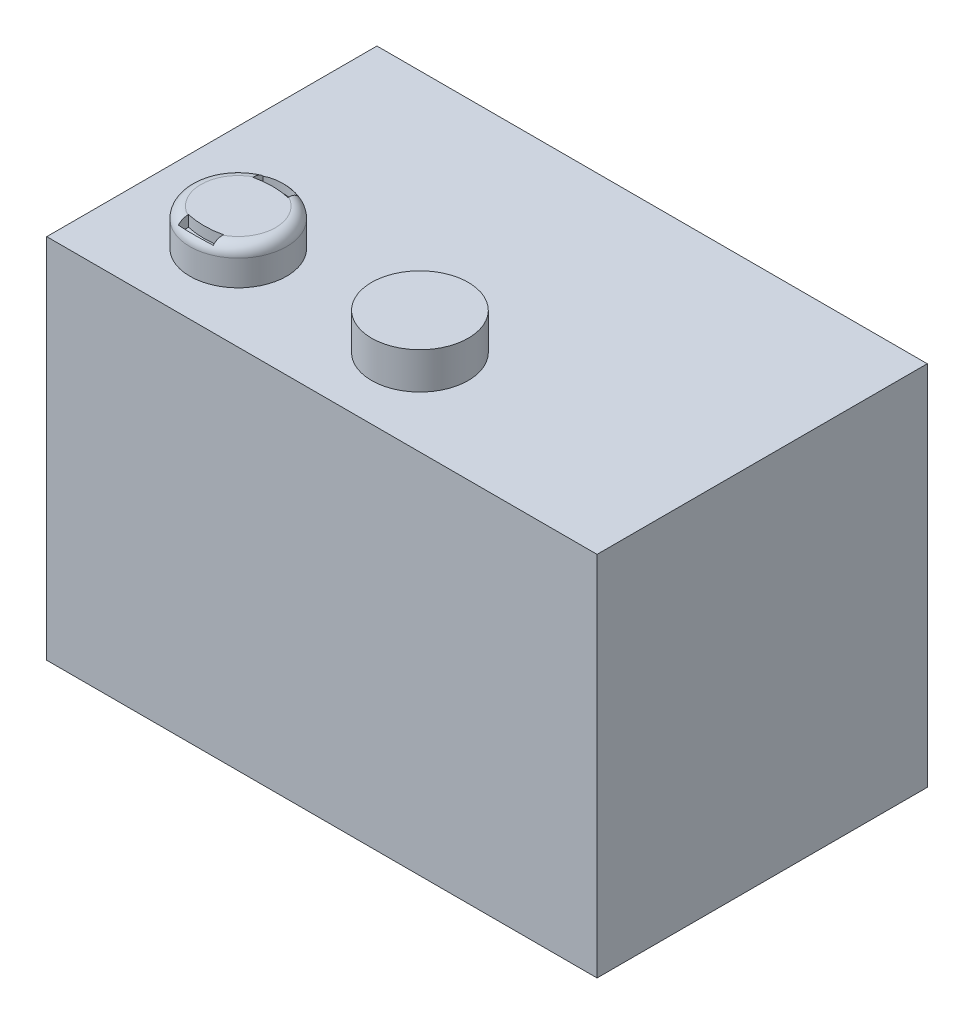
from build123d import *

# Parameters (mm, degrees)
ESQUISSE1_W             = 150
ESQUISSE1_H             = 100
BOSS_EXTRU_1_DEPTH      = 90
ESQUISSE2_R             = 13.17894546
BOSS_EXTRU_2_DEPTH      = 10
BOSS_EXTRU_2_2_DEPTH    = 10
CONG_1_R                = 3
ENL_V_MAT_EXTRU_3_DEPTH = 3


with BuildPart() as part:
    # Esquisse1 → Boss.-Extru.1 (new body)
    with BuildSketch(Plane.XY):
        with Locations((75, -50)):
            Rectangle(ESQUISSE1_W, ESQUISSE1_H)
    extrude(amount=BOSS_EXTRU_1_DEPTH)


with BuildPart() as body_2:
    # Esquisse2 → Boss.-Extru.2 (new body)
    with BuildSketch(Plane(origin=(0, 0, 0), x_dir=(1, 0, 0), z_dir=(0, 1, 0))):
        with Locations(Location((28.873561902, -66.674797835, 0), (0, 0, 270))):
            Circle(ESQUISSE2_R)
    extrude(amount=BOSS_EXTRU_2_DEPTH)

    # Congé1
    cong_1_edges = [body_2.edges().sort_by_distance(p)[0] for p in [
        (28.873561902, 10, 53.495852375),
    ]]
    fillet(cong_1_edges, radius=CONG_1_R)

    # Esquisse3 → Enlèv. mat.-Extru.3 (cut)
    with BuildSketch(Plane(origin=(0, 10, 0), x_dir=(1, 0, 0), z_dir=(0, 1, 0))):
        with BuildLine():
            Line((24.11468515, -75.462687014), (24.11468515, -78.244799577))
            ThreePointArc((24.11468515, -78.244799577), (28.873561902, -78.787682402), (33.632438654, -78.244799577))
            Line((33.632438654, -78.244799577), (33.632438654, -75.462687014))
            ThreePointArc((33.632438654, -75.462687014), (28.873561902, -76.005569839), (24.11468515, -75.462687014))
        make_face()
        with BuildLine():
            Line((33.632438654, -57.886908657), (33.632438654, -55.104796094))
            ThreePointArc((33.632438654, -55.104796094), (28.873561902, -54.561913268), (24.11468515, -55.104796094))
            Line((24.11468515, -55.104796094), (24.11468515, -57.886908657))
            ThreePointArc((24.11468515, -57.886908657), (28.873561902, -57.344025831), (33.632438654, -57.886908657))
        make_face()
    extrude(amount=-ENL_V_MAT_EXTRU_3_DEPTH, mode=Mode.SUBTRACT)


with BuildPart() as body_3:
    # Esquisse2 → Boss.-Extru.2 2 (new body)
    with BuildSketch(Plane(origin=(0, 0, 0), x_dir=(1, 0, 0), z_dir=(0, 1, 0))):
        with Locations(Location((78.239649499, -66.520528812, 0), (0, 0, 270))):
            Circle(ESQUISSE2_R)
    extrude(amount=BOSS_EXTRU_2_2_DEPTH)


solid = Compound([part.part, body_2.part, body_3.part])
